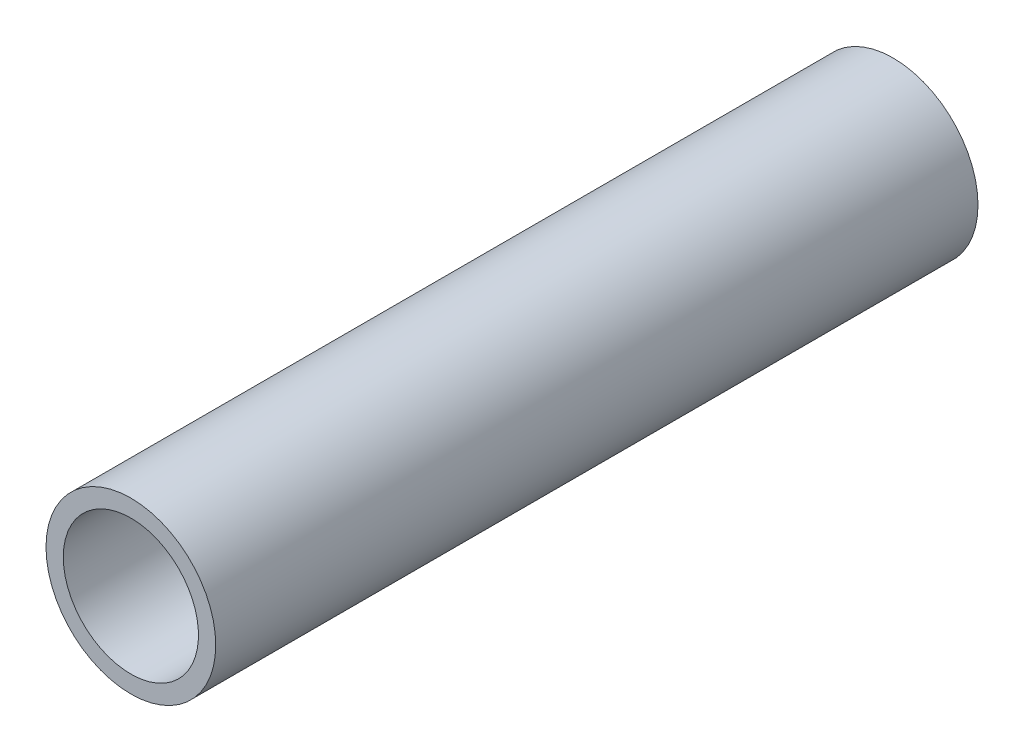
from build123d import *

# Parameters (mm, degrees)
SKETCH1_R           = 16.7
BOSS_EXTRUDE1_DEPTH = 150
SKETCH2_R           = 13.3
CUT_EXTRUDE1_DEPTH  = 150


with BuildPart() as part:
    # Sketch1 → Boss-Extrude1 (new body)
    with BuildSketch(Plane.XY):
        Circle(SKETCH1_R)
    extrude(amount=BOSS_EXTRUDE1_DEPTH)

    # Sketch2 → Cut-Extrude1 (cut)
    with BuildSketch(Plane(origin=(0, 0, 0), x_dir=(-1, 0, 0), z_dir=(0, 0, -1))):
        Circle(SKETCH2_R)
    extrude(amount=-CUT_EXTRUDE1_DEPTH, mode=Mode.SUBTRACT)


solid = part.part
